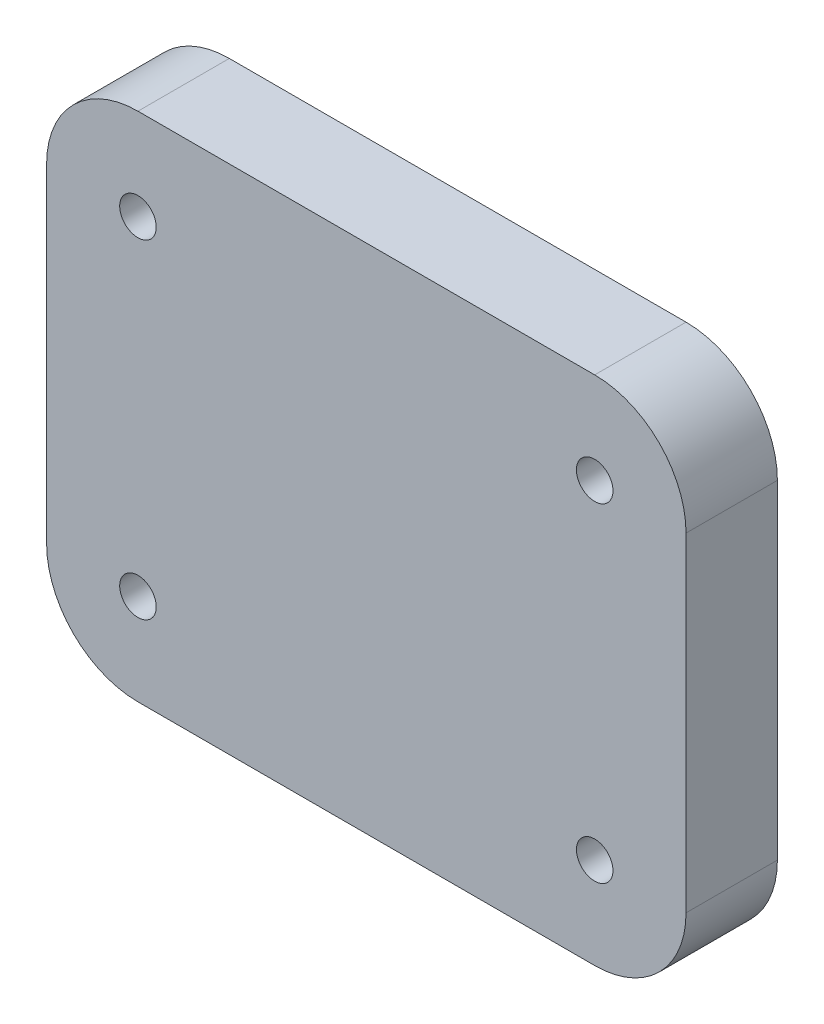
from build123d import *

# Parameters (mm, degrees)
SKETCH1_W           = 35
SKETCH1_H           = 28
BOSS_EXTRUDE1_DEPTH = 5
FILLET1_R           = 5
SKETCH2_R           = 1
CUT_EXTRUDE1_DEPTH  = 23.961925006


with BuildPart() as part:
    # Sketch1 → Boss-Extrude1 (new body)
    with BuildSketch(Plane.XY):
        Rectangle(SKETCH1_W, SKETCH1_H)
    extrude(amount=BOSS_EXTRUDE1_DEPTH)

    # Fillet1
    fillet1_edges = [part.edges().sort_by_distance(p)[0] for p in [
        (17.5, 14, 2.5),
        (17.5, -14, 2.5),
        (-17.5, -14, 2.5),
        (-17.5, 14, 2.5),
    ]]
    fillet(fillet1_edges, radius=FILLET1_R)

    # Sketch2 → Cut-Extrude1 (cut, through all)
    with BuildSketch(Plane.XY.offset(5)):
        with Locations((-12.5, -9)):
            Circle(SKETCH2_R)
        with Locations((-12.5, 9)):
            Circle(SKETCH2_R)
        with Locations((12.5, 9)):
            Circle(SKETCH2_R)
        with Locations((12.5, -9)):
            Circle(SKETCH2_R)
    extrude(amount=-CUT_EXTRUDE1_DEPTH, mode=Mode.SUBTRACT)


solid = part.part
